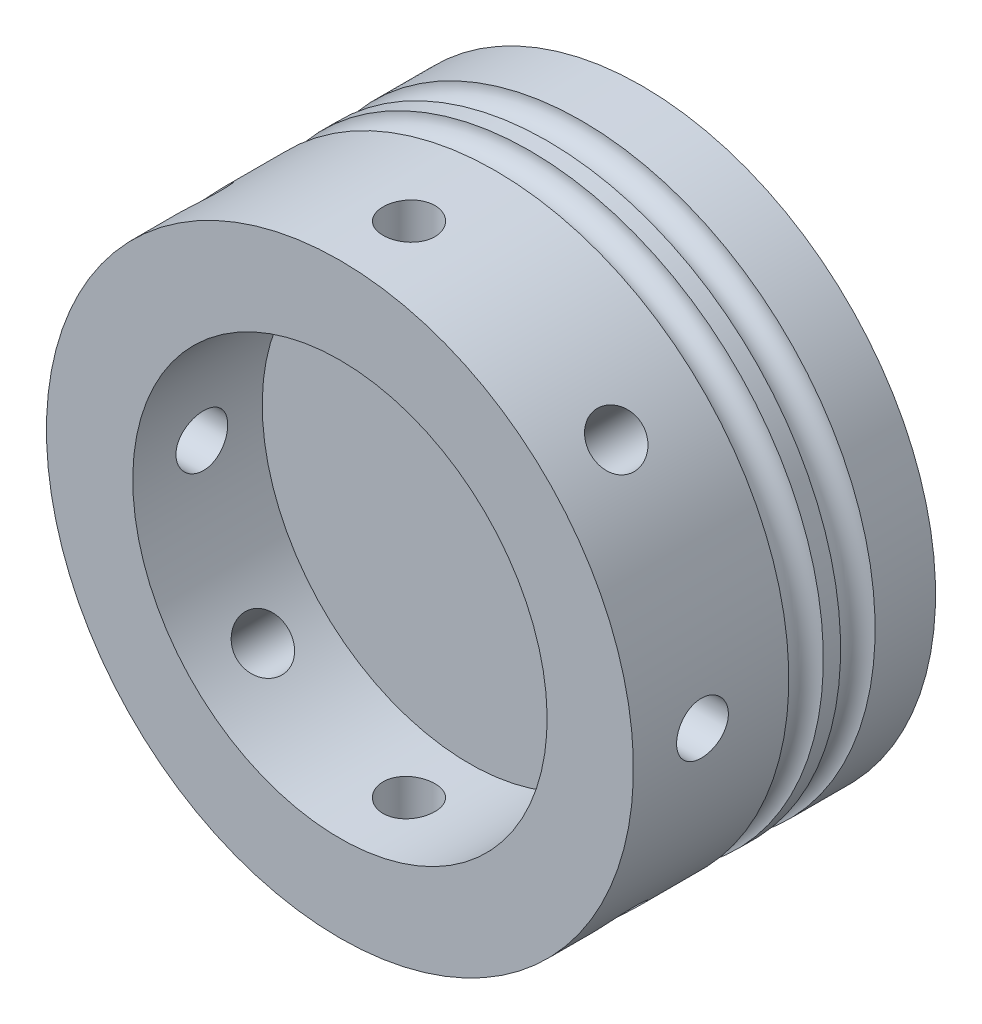
from build123d import *

# Parameters (mm, degrees)
SKETCH2_R          = 3
CUT_EXTRUDE3_DEPTH = 12.5
CIRPATTERN1_COUNT  = 8


with BuildPart() as part:
    # Sketch1 → Revolve1 (revolve)
    with BuildSketch(Plane(origin=(0, 0, 0), x_dir=(0, 0, -1), z_dir=(1, 0, 0)), mode=Mode.PRIVATE) as revolve1_sk:
        with BuildLine():
            Line((0, 0), (0, -10))
            Line((0, -10), (18, -10))
            ThreePointArc((18, -10), (20, -8), (22, -10))
            Line((22, -10), (24, -10))
            ThreePointArc((24, -10), (26, -8), (28, -10))
            Line((28, -10), (35, -10))
            Line((35, -10), (35, 24))
            Line((35, 24), (15, 24))
            Line((15, 24), (15, 0))
            Line((15, 0), (0, 0))
        make_face()
    revolve(revolve1_sk.sketch.rotate(Axis((0, 24, -35), (0, 0, 1)), 180), axis=Axis((0, 24, -35), (0, 0, 1)))

    # Sketch2 → Cut-Extrude3 (cut, symmetric)
    with BuildSketch(Plane(origin=(0, 0, 0), x_dir=(1, 0, 0), z_dir=(0, 1, 0))):
        with Locations(Location((0, 8, 0), (0, 0, 270))):
            Circle(SKETCH2_R)
    cut_extrude3 = extrude(amount=CUT_EXTRUDE3_DEPTH, both=True, mode=Mode.SUBTRACT)

    # CirPattern1: Cut-Extrude3 ×8 about axis
    cirpattern1_axis = Axis((0, 24, -35), (0, 0, -1))
    for i in range(1, CIRPATTERN1_COUNT):
        add(cut_extrude3.rotate(cirpattern1_axis, i * 360 / CIRPATTERN1_COUNT), mode=Mode.SUBTRACT)


solid = part.part
